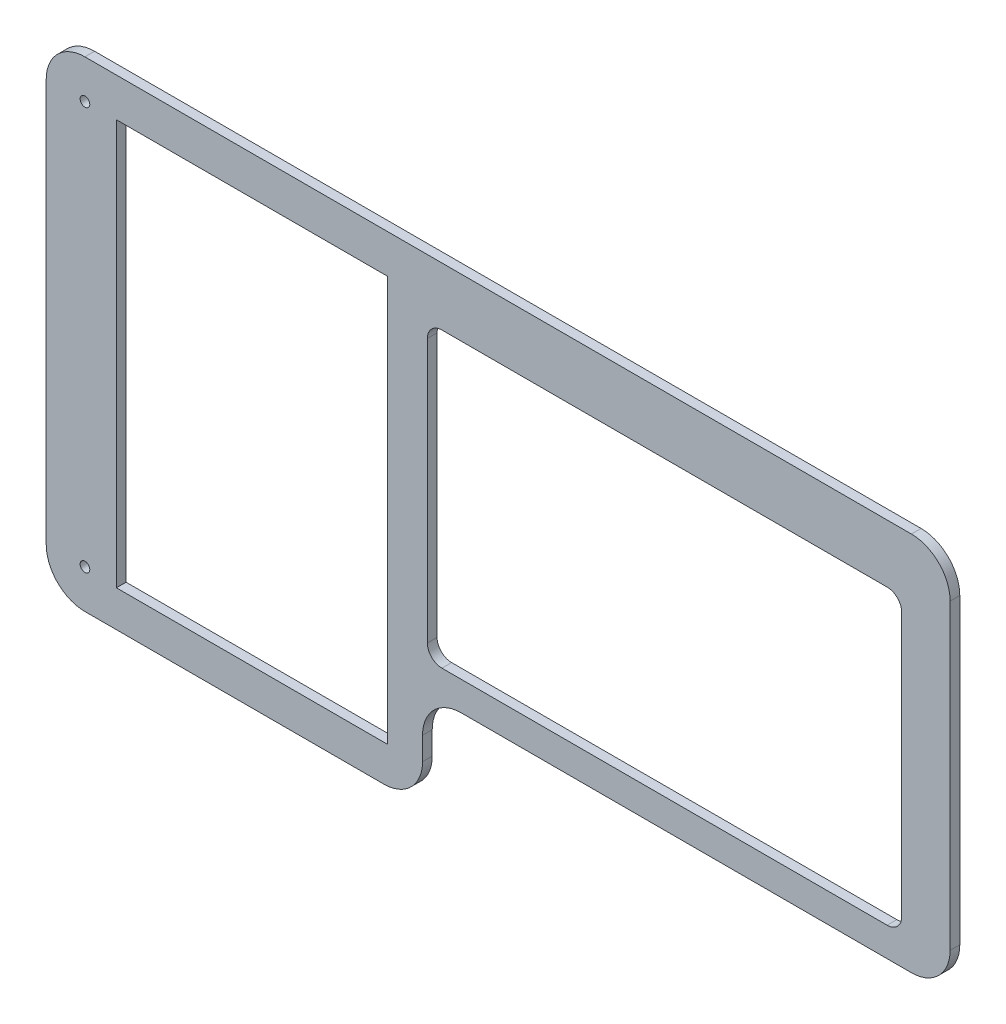
from build123d import *

# Parameters (mm, degrees)
MAIN_EXTRUDE_DEPTH      = 2
SCREWHOLES_DEPTH        = 142.046534874
SCREWHOLES_DEPTH_BACK   = 142.046534874
SKETCH2_R               = 1
CUT_EXTRUDE2_DEPTH      = 142.046534874
CUT_EXTRUDE2_DEPTH_BACK = 142.046534874
SKETCH3_W               = 56
SKETCH3_H               = 83.75


with BuildPart() as part:
    # Sketch1 → Main extrude (new body)
    with BuildSketch(Plane.XY):
        with BuildLine():
            Line((-50, -51.75), (-50, -47))
            ThreePointArc((-50, -47), (-47.656854249, -41.343145751), (-42, -39))
            Line((-42, -39), (51, -39))
            ThreePointArc((51, -39), (56.656854249, -36.656854249), (59, -31))
            Line((59, -31), (59, 31.5))
            ThreePointArc((59, 31.5), (56.656854249, 37.156854249), (51, 39.5))
            Line((51, 39.5), (-119.75, 39.5))
            ThreePointArc((-119.75, 39.5), (-125.406854249, 37.156854249), (-127.75, 31.5))
            Line((-127.75, 31.5), (-127.75, -51.75))
            ThreePointArc((-127.75, -51.75), (-125.406854249, -57.406854249), (-119.75, -59.75))
            Line((-119.75, -59.75), (-58, -59.75))
            ThreePointArc((-58, -59.75), (-52.343145751, -57.406854249), (-50, -51.75))
        make_face()
    extrude(amount=MAIN_EXTRUDE_DEPTH)

    # Sketch2 → Screwholes (cut, two sides: drawn at the far end of the back side and taken through both)
    with BuildSketch(Plane.XY.offset(2).offset(-SCREWHOLES_DEPTH_BACK)):
        with Locations((-119.75, 31.5)):
            Circle(SKETCH2_R)
        with Locations((-119.75, -51.75)):
            Circle(SKETCH2_R)
    extrude(amount=SCREWHOLES_DEPTH + SCREWHOLES_DEPTH_BACK, mode=Mode.SUBTRACT)

    # Sketch3 → Cut-Extrude2 (cut, two sides: drawn at the far end of the back side and taken through both)
    with BuildSketch(Plane.XY.offset(2).offset(-CUT_EXTRUDE2_DEPTH_BACK)):
        with Locations((-85.25, -10.375)):
            Rectangle(SKETCH3_W, SKETCH3_H)
        with BuildLine():
            Line((-46, 27.5), (46, 27.5))
            ThreePointArc((46, 27.5), (48.121320344, 26.621320344), (49, 24.5))
            Line((49, 24.5), (49, -30))
            ThreePointArc((49, -30), (48.121320344, -32.121320344), (46, -33))
            Line((46, -33), (-46, -33))
            ThreePointArc((-46, -33), (-48.121320344, -32.121320344), (-49, -30))
            Line((-49, -30), (-49, 24.5))
            ThreePointArc((-49, 24.5), (-48.121320344, 26.621320344), (-46, 27.5))
        make_face()
    extrude(amount=CUT_EXTRUDE2_DEPTH + CUT_EXTRUDE2_DEPTH_BACK, mode=Mode.SUBTRACT)


solid = part.part
